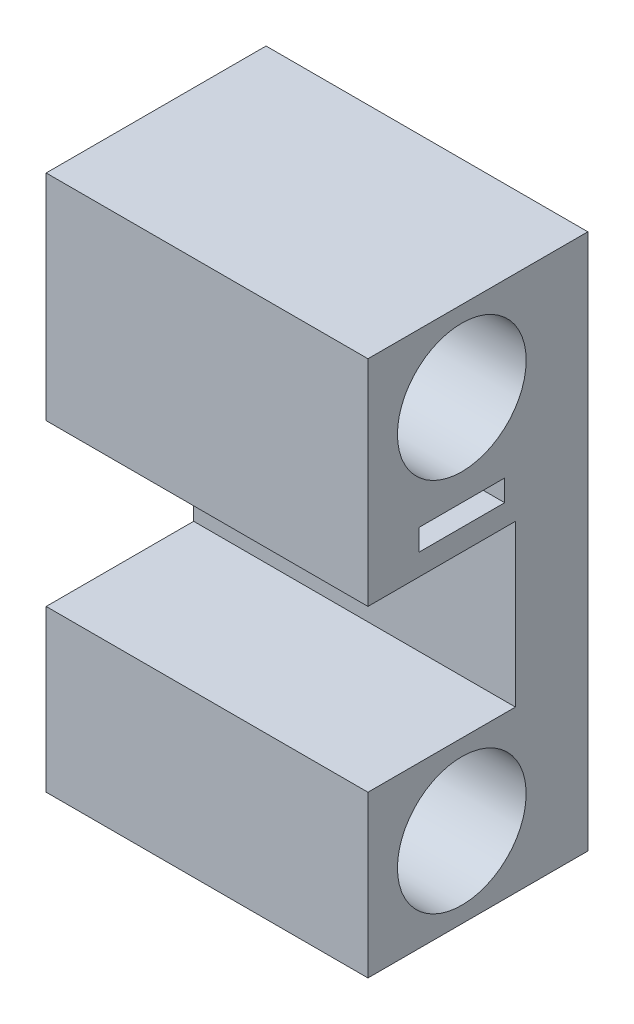
from build123d import *

# Parameters (mm, degrees)
SKETCH1_W               = 60
SKETCH1_H               = 100
BOSS_EXTRUDE1_DEPTH     = 35
CUT_EXTRUDE1_DEPTH      = 86.586213843
CUT_EXTRUDE1_DEPTH_BACK = 86.586213843
SKETCH3_R               = 12
SKETCH3_W               = 16
SKETCH3_H               = 4
CUT_EXTRUDE2_DEPTH      = 86.586213843
CUT_EXTRUDE2_DEPTH_BACK = 86.586213843
SKETCH4_W               = 27.5
SKETCH4_H               = 30
SKETCH5_R               = 1.5
CUT_EXTRUDE3_DEPTH      = 12
SKETCH6_R               = 2.75
CUT_EXTRUDE4_DEPTH      = 2
SKETCH7_W               = 60
SKETCH7_H               = 100
BOSS_EXTRUDE2_DEPTH     = 6
SKETCH11_W              = 3
SKETCH11_H              = 40
CUT_EXTRUDE8_DEPTH      = 50
SKETCH9_R               = 1.5
CUT_EXTRUDE9_DEPTH      = 8
SKETCH12_R              = 2.85
CUT_EXTRUDE10_DEPTH     = 1


with BuildPart() as part:
    # Sketch1 → Boss-Extrude1 (new body)
    with BuildSketch(Plane.XY):
        Rectangle(SKETCH1_W, SKETCH1_H)
    extrude(amount=BOSS_EXTRUDE1_DEPTH)

    # Sketch3 → Cut-Extrude1 (cut, two sides: drawn at the far end of the back side and taken through both)
    with BuildSketch(Plane(origin=(30, 0, 0), x_dir=(0, 0, -1), z_dir=(1, 0, 0)).offset(-CUT_EXTRUDE1_DEPTH_BACK)):
        with Locations((-17.5, 35)):
            Circle(SKETCH3_R)
        with Locations(Location((-17.5, -35, 0), (0, 0, 180))):
            Circle(SKETCH3_R)
        with Locations((-17.5, 16)):
            Rectangle(SKETCH3_W, SKETCH3_H)
    extrude(amount=CUT_EXTRUDE1_DEPTH + CUT_EXTRUDE1_DEPTH_BACK, mode=Mode.SUBTRACT)

    # Sketch4 → Cut-Extrude2 (cut, two sides: drawn at the far end of the back side and taken through both)
    with BuildSketch(Plane(origin=(30, 0, 0), x_dir=(0, 0, -1), z_dir=(1, 0, 0)).offset(-CUT_EXTRUDE2_DEPTH_BACK)):
        with Locations((-21.25, -5)):
            Rectangle(SKETCH4_W, SKETCH4_H)
    extrude(amount=CUT_EXTRUDE2_DEPTH + CUT_EXTRUDE2_DEPTH_BACK, mode=Mode.SUBTRACT)

    # Sketch5 → Cut-Extrude3 (cut)
    with BuildSketch(Plane.XZ.offset(-10)):
        with Locations(Location((-18, 20.569825058, 0), (0, 0, 270))):
            Circle(SKETCH5_R)
        with Locations(Location((-6, 20.569825058, 0), (0, 0, 270))):
            Circle(SKETCH5_R)
        with Locations(Location((6, 20.569825058, 0), (0, 0, 270))):
            Circle(SKETCH5_R)
        with Locations(Location((18, 20.569825058, 0), (0, 0, 270))):
            Circle(SKETCH5_R)
    extrude(amount=-CUT_EXTRUDE3_DEPTH, mode=Mode.SUBTRACT)

    # Sketch6 → Cut-Extrude4 (cut)
    with BuildSketch(Plane.XZ.offset(-10)):
        with Locations(Location((-18, 20.569825058, 0), (0, 0, 270))):
            Circle(SKETCH6_R)
        with Locations(Location((-6, 20.569825058, 0), (0, 0, 270))):
            Circle(SKETCH6_R)
        with Locations(Location((6, 20.569825058, 0), (0, 0, 270))):
            Circle(SKETCH6_R)
        with Locations(Location((18, 20.569825058, 0), (0, 0, 270))):
            Circle(SKETCH6_R)
    extrude(amount=-CUT_EXTRUDE4_DEPTH, mode=Mode.SUBTRACT)

    # Sketch7 → Boss-Extrude2 (add)
    with BuildSketch(Plane(origin=(0, 0, 0), x_dir=(-1, 0, 0), z_dir=(0, 0, -1))):
        Rectangle(SKETCH7_W, SKETCH7_H)
    extrude(amount=BOSS_EXTRUDE2_DEPTH)

    # Sketch11 → Cut-Extrude8 (cut)
    with BuildSketch(Plane.ZY.offset(30)):
        with Locations((-3, 0)):
            Rectangle(SKETCH11_W, SKETCH11_H)
    extrude(amount=-CUT_EXTRUDE8_DEPTH, mode=Mode.SUBTRACT)

    # Sketch9 → Cut-Extrude9 (cut)
    with BuildSketch(Plane(origin=(0, 0, -6), x_dir=(-1, 0, 0), z_dir=(0, 0, -1))):
        with Locations((-12.5, 12.5)):
            Circle(SKETCH9_R)
        with Locations(Location((-12.5, -12.5, 0), (0, 0, 180))):
            Circle(SKETCH9_R)
        with Locations((22.5, -12.5)):
            Circle(SKETCH9_R)
        with Locations(Location((22.5, 12.5, 0), (0, 0, 180))):
            Circle(SKETCH9_R)
    extrude(amount=-CUT_EXTRUDE9_DEPTH, mode=Mode.SUBTRACT)

    # Sketch12 → Cut-Extrude10 (cut)
    with BuildSketch(Plane(origin=(0, 0, -6), x_dir=(-1, 0, 0), z_dir=(0, 0, -1))):
        with Locations((-12.5, 12.5)):
            Circle(SKETCH12_R)
        with Locations((22.5, 12.5)):
            Circle(SKETCH12_R)
        with Locations((22.5, -12.5)):
            Circle(SKETCH12_R)
        with Locations((-12.5, -12.5)):
            Circle(SKETCH12_R)
    extrude(amount=-CUT_EXTRUDE10_DEPTH, mode=Mode.SUBTRACT)


solid = part.part
